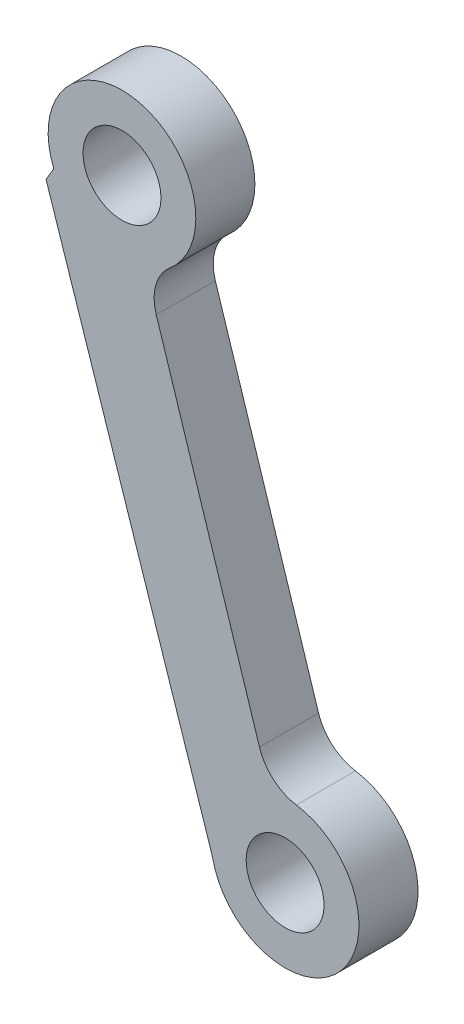
from build123d import *

# Parameters (mm, degrees)
SKETCH1_R           = 2.6375
BOSS_EXTRUDE1_DEPTH = 4


with BuildPart() as part:
    # Sketch1 → Boss-Extrude1 (new body)
    with BuildSketch(Plane.XY.offset(4)):
        with BuildLine():
            Line((18.121313038, 57.499552699), (11.130625568, 79.363045761))
            ThreePointArc((11.130625568, 79.363045761), (11.103854309, 81.101969158), (12.046376558, 82.563551551))
            ThreePointArc((12.046376558, 82.563551551), (9.982846794, 91.235495297), (4.191986809, 84.458570917))
            Line((4.191986809, 84.458570917), (3.669492538, 83.571702076))
            Line((3.669492538, 83.571702076), (14.841853522, 49.779462629))
            Line((14.841853522, 49.779462629), (15.118467898, 48.820925017))
            ThreePointArc((15.118467898, 48.820925017), (23.681425942, 47.199148201), (20.62266155, 55.359930695))
            ThreePointArc((20.62266155, 55.359930695), (19.067995929, 56.074357266), (18.121313038, 57.499552699))
        make_face()
        with Locations(Location((19.856196321, 50.419026825, 0), (0, 0, 180))):
            Circle(SKETCH1_R, mode=Mode.SUBTRACT)
        with Locations(Location((8.810151598, 86.374961789, 0), (0, 0, 180))):
            Circle(SKETCH1_R, mode=Mode.SUBTRACT)
    extrude(amount=-BOSS_EXTRUDE1_DEPTH)


solid = part.part
